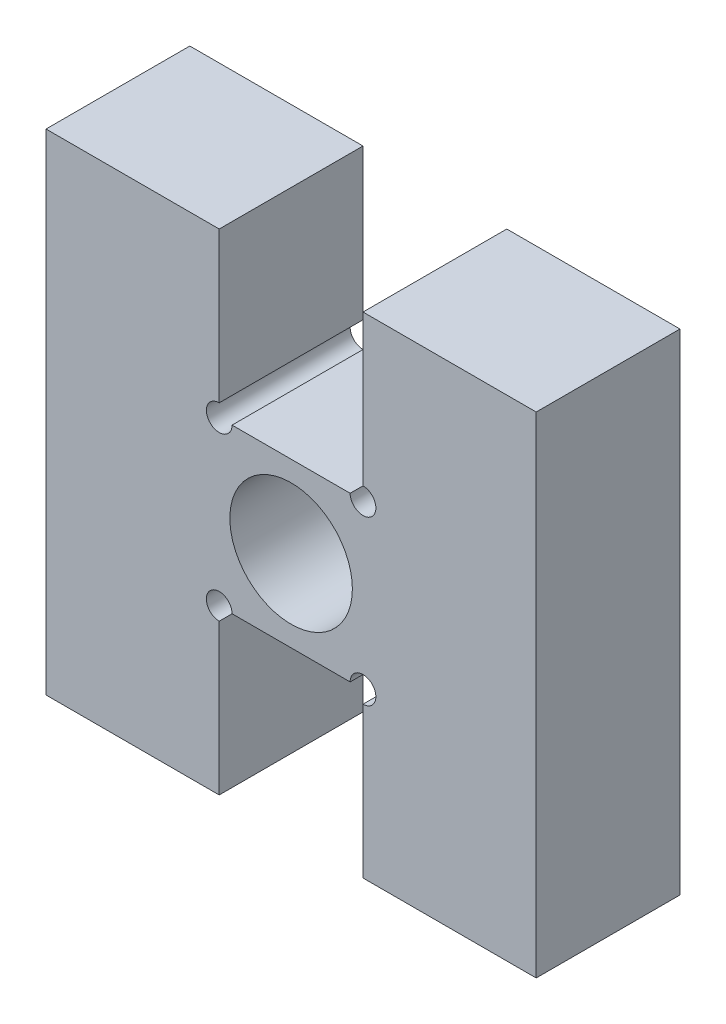
from build123d import *

# Parameters (mm, degrees)
SKETCH1_R               = 2.38125
BOSS_EXTRUDE1_DEPTH     = 5.588
CUT_EXTRUDE2_DEPTH      = 15.583449318
CUT_EXTRUDE2_DEPTH_BACK = 15.583449318
SKETCH2_R               = 0.5


with BuildPart() as part:
    # Sketch1 → Boss-Extrude1 (new body)
    with BuildSketch(Plane.XY):
        Polygon((-2.794, 3.175), (-2.794, 9.525), (-9.525, 9.525), (-9.525, -9.525), (-2.794, -9.525), (-2.794, -3.175), (2.794, -3.175), (2.794, -9.525), (9.525, -9.525), (9.525, 9.525), (2.794, 9.525), (2.794, 3.175), align=None)
        Circle(SKETCH1_R, mode=Mode.SUBTRACT)
    extrude(amount=BOSS_EXTRUDE1_DEPTH)

    # Sketch2 → Cut-Extrude2 (cut, two sides: drawn at the far end of the back side and taken through both)
    with BuildSketch(Plane.XY.offset(-CUT_EXTRUDE2_DEPTH_BACK)):
        with Locations((-2.794, 3.175)):
            Circle(SKETCH2_R)
        with Locations((2.794, 3.175)):
            Circle(SKETCH2_R)
        with Locations((2.794, -3.175)):
            Circle(SKETCH2_R)
        with Locations((-2.794, -3.175)):
            Circle(SKETCH2_R)
    extrude(amount=CUT_EXTRUDE2_DEPTH + CUT_EXTRUDE2_DEPTH_BACK, mode=Mode.SUBTRACT)


solid = part.part
